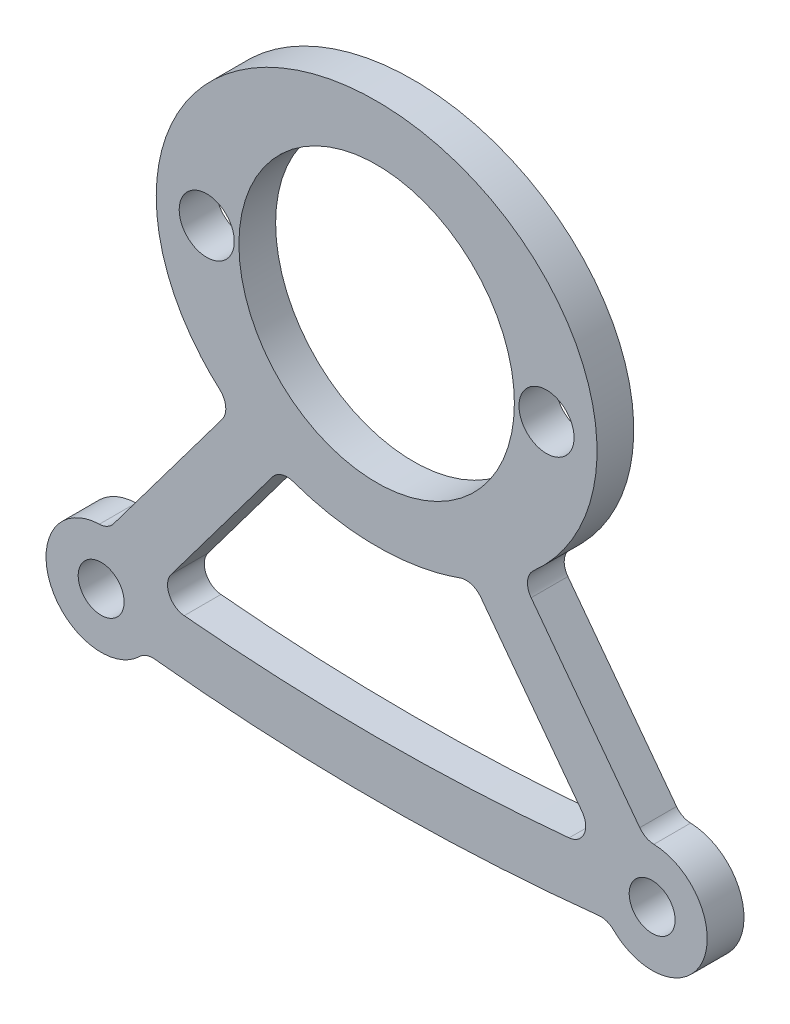
from build123d import *

# Parameters (mm, degrees)
SKETCH_1_R         = 3
SKETCH_1_R_2       = 1
EXTRUDE_1_DEPTH    = 2
EXTRUDE_1_2_DEPTH  = 2
SKETCH_1_RX        = 12
SKETCH_1_RY        = 10.5
SKETCH_1_R_3       = 7.5
SKETCH_1_R_4       = 1.5
EXTRUDE_1_3_DEPTH  = 2
EXTRUDE_START      = -2
EXTRUDE_3_DEPTH    = 2
FILLET_3_R         = 1
EXTRUDE_4_DEPTH    = 2
HOLE_WIZARD_M3_1_D = 2.5


with BuildPart() as part:
    # ｽｹｯﾁ1 → ﾎﾞｽ - 押し出し1 (new body)
    with BuildSketch(Plane.XY):
        with Locations((-15, -20)):
            Circle(SKETCH_1_R)
        with Locations((-15, -20)):
            Circle(SKETCH_1_R_2, mode=Mode.SUBTRACT)
    extrude(amount=EXTRUDE_1_DEPTH)



with BuildPart() as body_2:
    # ｽｹｯﾁ1 → Extrude 1 2 (new body)
    with BuildSketch(Plane.XY):
        with Locations(Location((15, -20, 0), (0, 0, 180))):
            Circle(SKETCH_1_R)
        with Locations(Location((15, -20, 0), (0, 0, 180))):
            Circle(SKETCH_1_R_2, mode=Mode.SUBTRACT)
    extrude(amount=EXTRUDE_1_2_DEPTH)


with BuildPart() as body_3:
    # ｽｹｯﾁ1 → Extrude 1 3 (new body)
    with BuildSketch(Plane.XY):
        with Locations((0, 0)):
            Ellipse(SKETCH_1_RX, SKETCH_1_RY)
        Circle(SKETCH_1_R_3, mode=Mode.SUBTRACT)
        with Locations((9.25, 0)):
            Circle(SKETCH_1_R_4, mode=Mode.SUBTRACT)
        with Locations(Location((-9.25, 0, 0), (0, 0, 180))):
            Circle(SKETCH_1_R_4, mode=Mode.SUBTRACT)
    extrude(amount=EXTRUDE_1_3_DEPTH)


with BuildPart() as part_1:
    add(part.part)

    add(body_2.part)  # ﾎﾞｽ - 押し出し3 merges body 2

    add(body_3.part)  # ﾎﾞｽ - 押し出し3 merges body 3
    # ｽｹｯﾁ7 → ﾎﾞｽ - 押し出し3 (add)
    with BuildSketch(Plane.XY.offset(2).offset(EXTRUDE_START)):
        with BuildLine():
            Line((-7.838039348, -7.95071913), (-14.641154273, -17.021539031))
            ThreePointArc((-14.641154273, -17.021539031), (-13.2, -17.6), (-12.241154273, -18.821539031))
            Line((-12.241154273, -18.821539031), (-5.216878938, -9.455838584))
            add(Edge.make_bspline(
                [(-7.838039348, -7.95071913), (-6.640783086, -8.854377448), (-5.216878938, -9.455838584)],
                knots=[4.000625721, 4.000625721, 4.000625721, 4.262639533, 4.262639533, 4.262639533], degree=2, weights=[1, 0.991430862, 1]))
        make_face()
        with BuildLine():
            Line((5.216878938, -9.455838584), (12.241154273, -18.821539031))
            ThreePointArc((12.241154273, -18.821539031), (13.2, -17.6), (14.641154273, -17.021539031))
            Line((14.641154273, -17.021539031), (7.838039348, -7.95071913))
            add(Edge.make_bspline(
                [(5.216878938, -9.455838584), (6.640783086, -8.854377448), (7.838039348, -7.95071913)],
                knots=[2.020545775, 2.020545775, 2.020545775, 2.282559586, 2.282559586, 2.282559586], degree=2, weights=[1, 0.991430862, 1]))
        make_face()
        with BuildLine():
            ThreePointArc((-12.603200099, -21.804258915), (0, -22.5), (12.603200099, -21.804258915))
            ThreePointArc((12.603200099, -21.804258915), (12.022167048, -20.364020483), (12.239155559, -18.826229166))
            ThreePointArc((12.239155559, -18.826229166), (0, -19.5), (-12.239155559, -18.826229166))
            ThreePointArc((-12.239155559, -18.826229166), (-12.022167048, -20.364020483), (-12.603200099, -21.804258915))
        make_face()
    extrude(amount=EXTRUDE_3_DEPTH)

    # ﾌｨﾚｯﾄ3
    fillet_3_edges = [part_1.edges().sort_by_distance(p)[0] for p in [
        (-7.838039348, -7.95071913, 1),
        (7.838039348, -7.95071913, 1),
        (-14.641154273, -17.021539031, 1),
        (14.641154273, -17.021539031, 1),
        (12.603200099, -21.804258915, 1),
        (-12.603200099, -21.804258915, 1),
        (-5.216878938, -9.455838584, 1),
        (5.216878938, -9.455838584, 1),
    ]]
    fillet(fillet_3_edges, radius=FILLET_3_R)

    # ｽｹｯﾁ8 → ﾎﾞｽ - 押し出し4 (add)
    with BuildSketch(Plane.XY.offset(2).offset(EXTRUDE_START)):
        with BuildLine():
            Line((-12.241154273, -18.821539031), (-11.183307296, -17.411076395))
            ThreePointArc((-11.183307296, -17.411076395), (-11.297779405, -18.415725331), (-10.477273878, -19.006651747))
            ThreePointArc((-10.477273878, -19.006651747), (-11.358572959, -18.919938786), (-12.239155559, -18.826229166))
            ThreePointArc((-12.239155559, -18.826229166), (-12.24015392, -18.823883674), (-12.241154273, -18.821539031))
        make_face()
        with BuildLine():
            Line((12.241154273, -18.821539031), (11.183307296, -17.411076395))
            ThreePointArc((11.183307296, -17.411076395), (11.297779405, -18.415725331), (10.477273878, -19.006651747))
            ThreePointArc((10.477273878, -19.006651747), (11.358572959, -18.919938786), (12.239155559, -18.826229166))
            ThreePointArc((12.239155559, -18.826229166), (12.24015392, -18.823883674), (12.241154273, -18.821539031))
        make_face()
    extrude(amount=EXTRUDE_4_DEPTH)

    # M3 ねじ穴1 (through all)
    with Locations(Plane(origin=(0, 0, 0), x_dir=(-1, 0, 0), z_dir=(0, 0, -1))):
        with Locations((-15, -20), (15, -20)):
            Hole(HOLE_WIZARD_M3_1_D / 2)


solid = part_1.part
